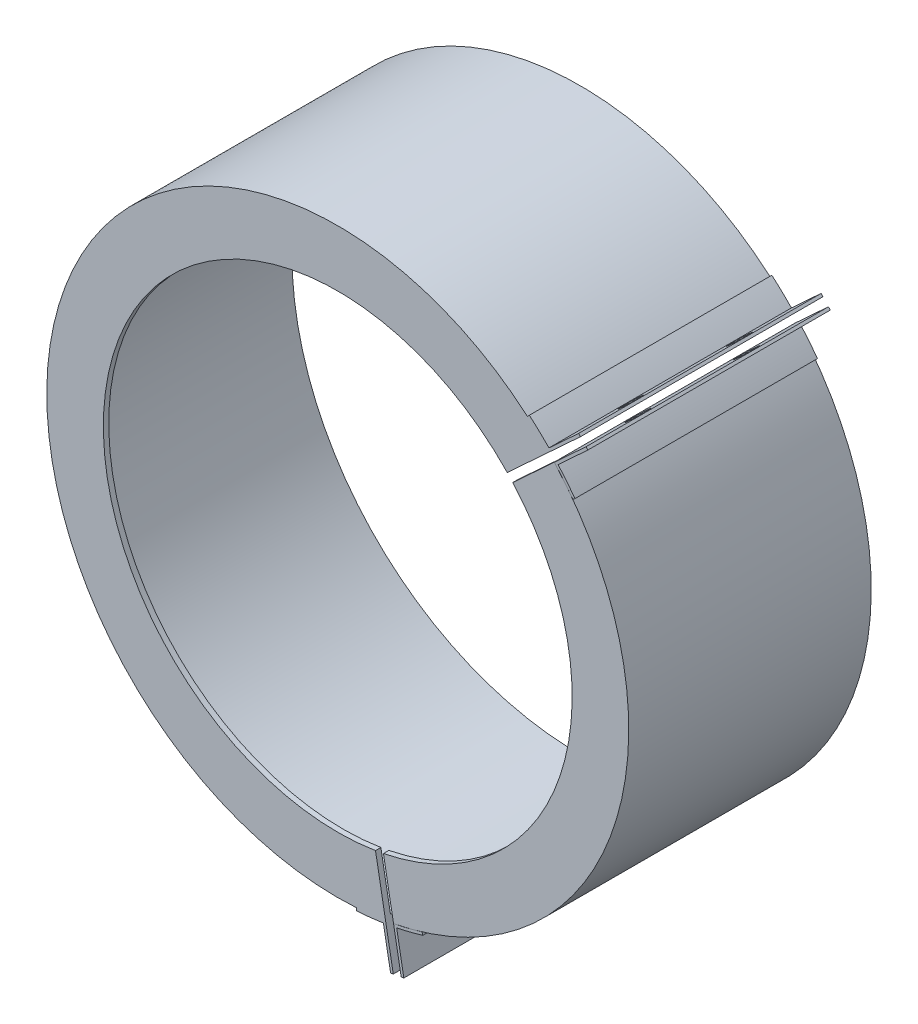
from build123d import *

# Parameters (mm, degrees)
SKETCH1_R           = 108
SKETCH1_R_2         = 107
BOSS_EXTRUDE1_DEPTH = 90
BOSS_EXTRUDE2_START = -2
SKETCH5_R           = 107
SKETCH5_R_2         = 87
BOSS_EXTRUDE2_DEPTH = 2
CUT_EXTRUDE1_DEPTH  = 178.279440432
BOSS_EXTRUDE3_DEPTH = 90
SKETCH7_R           = 4
CUT_EXTRUDE2_DEPTH  = 189.630747631


with BuildPart() as part:
    # Sketch1 → Boss-Extrude1 (new body)
    with BuildSketch(Plane.XY):
        with Locations(Location((0, 0, 0), (0, 0, 180))):
            Circle(SKETCH1_R)
        with Locations(Location((0, 0, 0), (0, 0, 180))):
            Circle(SKETCH1_R_2, mode=Mode.SUBTRACT)
    extrude(amount=BOSS_EXTRUDE1_DEPTH)

    # Sketch5 → Boss-Extrude2 (add)
    with BuildSketch(Plane.XY.offset(90).offset(BOSS_EXTRUDE2_START)):
        with Locations(Location((0, 0, 0), (0, 0, 180))):
            Circle(SKETCH5_R)
        Circle(SKETCH5_R_2, mode=Mode.SUBTRACT)
    extrude(amount=BOSS_EXTRUDE2_DEPTH)

    # Sketch3 → Cut-Extrude1 (cut, through all)
    with BuildSketch(Plane.XY.offset(90)):
        Polygon((78.341510836, 74.356288771), (62.901105553, 60.10366811), (64.935941148, 57.899253425), (80.376346432, 72.151874087), align=None)
        Polygon((14.00719823, -85.865001006), (17.747390761, -106.5423865), (20.699485047, -106.008402114), (16.959292516, -85.33101662), align=None)
    extrude(amount=-CUT_EXTRUDE1_DEPTH, mode=Mode.SUBTRACT)


with BuildPart() as cut_extrude1_piece_1:
    # of the separate pieces the step leaves, piece 1, a body of its own (cut_extrude1_pieces)
    add(part.part.solids().sort_by_distance((78.33385625, 74.349223029, 0))[0])

    # Sketch6 → Boss-Extrude3 (add, through all)
    with BuildSketch(Plane.XY):
        with BuildLine():
            Line((78.33385625, 74.349223029), (90.090734566, 85.201679537))
            Line((90.090734566, 85.201679537), (89.412456034, 85.936484432))
            Line((89.412456034, 85.936484432), (78.376967774, 75.749923581))
            ThreePointArc((78.376967774, 75.749923581), (74.819696806, 79.26545887), (71.104907327, 82.614115949))
            Line((71.104907327, 82.614115949), (70.452568728, 81.856188279))
            ThreePointArc((70.452568728, 81.856188279), (74.487842607, 78.202054345), (78.33385625, 74.349223029))
        make_face()
        with BuildLine():
            Line((80.368691845, 72.144808345), (92.125570161, 82.997264853))
            Line((92.125570161, 82.997264853), (92.803848693, 82.262459958))
            Line((92.803848693, 82.262459958), (81.768360433, 72.075899107))
            ThreePointArc((81.768360433, 72.075899107), (84.988520543, 68.2491859), (88.029753635, 64.278787131))
            Line((88.029753635, 64.278787131), (87.222141216, 63.689073487))
            ThreePointArc((87.222141216, 63.689073487), (83.902006499, 68.003333047), (80.368691845, 72.144808345))
        make_face()
        with BuildLine():
            Line((20.697630845, -105.998151292), (23.545547572, -121.742654153))
            Line((23.545547572, -121.742654153), (24.529579001, -121.564659357))
            Line((24.529579001, -121.564659357), (21.856407538, -106.786223126))
            ThreePointArc((21.856407538, -106.786223126), (26.731850905, -105.671226676), (31.55101549, -104.33375974))
            Line((31.55101549, -104.33375974), (31.261556633, -103.376569284))
            ThreePointArc((31.261556633, -103.376569284), (26.012640464, -104.820525357), (20.697630845, -105.998151292))
        make_face()
        with BuildLine():
            Line((19.609421857, -122.454633334), (16.936250395, -107.676197103))
            ThreePointArc((16.936250395, -107.676197103), (11.979147286, -108.33974354), (6.996824382, -108.775201441))
            Line((6.996824382, -108.775201441), (6.932633332, -107.777263813))
            ThreePointArc((6.932633332, -107.777263813), (12.354780586, -107.291003335), (17.745536559, -106.532135679))
            Line((17.745536559, -106.532135679), (20.593453286, -122.276638539))
            Line((20.593453286, -122.276638539), (19.609421857, -122.454633334))
        make_face()
    extrude(amount=BOSS_EXTRUDE3_DEPTH)


with BuildPart() as cut_extrude1_piece_2:
    # of the separate pieces the step leaves, piece 2, a body of its own (cut_extrude1_pieces)
    add(part.part.solids().sort_by_distance((20.697630845, -105.998151292, 0))[0])


with BuildPart() as boss_extrude3_piece_1:
    # of the separate pieces the step leaves, piece 1, a body of its own (boss_extrude3_pieces)
    add(cut_extrude1_piece_1.part.solids().sort_by_distance((70.452568728, 81.856188279, 0))[0])


with BuildPart() as boss_extrude3_piece_2:
    # of the separate pieces the step leaves, piece 2, a body of its own (boss_extrude3_pieces)
    add(cut_extrude1_piece_1.part.solids().sort_by_distance((20.697630845, -105.998151292, 0))[0])


with BuildPart() as boss_extrude3_piece_3:
    # of the separate pieces the step leaves, piece 3, a body of its own (boss_extrude3_pieces)
    add(cut_extrude1_piece_1.part.solids().sort_by_distance((87.222141216, 63.689073487, 0))[0])


with BuildPart() as cut_extrude2_tool:
    # Sketch7 → Cut-Extrude2 (new, through all)
    with BuildSketch(Plane(origin=(-1.695696329, 1.837012237, 0), x_dir=(0, 0, 1), z_dir=(-0.6782785317528589, 0.7348048947599533, 0))):
        with Locations(Location((24.846500871, 116.480454667, 0), (0, 0, 270))):
            Circle(SKETCH7_R)
        with Locations(Location((65.153499129, 116.480454667, 0), (0, 0, 270))):
            Circle(SKETCH7_R)
    cut_extrude2 = extrude(amount=-CUT_EXTRUDE2_DEPTH)


with BuildPart() as boss_extrude3_piece_1_1:
    add(boss_extrude3_piece_1.part)

    # Cut-Extrude2: cut by cut_extrude2_tool
    add(cut_extrude2_tool.part, mode=Mode.SUBTRACT)


with BuildPart() as boss_extrude3_piece_3_1:
    add(boss_extrude3_piece_3.part)

    # Cut-Extrude2: cut by cut_extrude2_tool
    add(cut_extrude2_tool.part, mode=Mode.SUBTRACT)


with BuildPart() as mirror4_tool:
    # Mirror4: Cut-Extrude2 across plane
    add(cut_extrude2.mirror(Plane(origin=(0, 0, 0), x_dir=(0, 0, 1), z_dir=(-0.31761703385268936, -0.9482190779596347, 0))))


with BuildPart() as boss_extrude3_piece_1_2:
    add(boss_extrude3_piece_1_1.part)

    # Mirror4: cut by mirror4_tool
    add(mirror4_tool.part, mode=Mode.SUBTRACT)


with BuildPart() as boss_extrude3_piece_2_1:
    add(boss_extrude3_piece_2.part)

    # Mirror4: cut by mirror4_tool
    add(mirror4_tool.part, mode=Mode.SUBTRACT)


solid = Compound([cut_extrude1_piece_2.part, boss_extrude3_piece_3_1.part, boss_extrude3_piece_1_2.part, boss_extrude3_piece_2_1.part])
